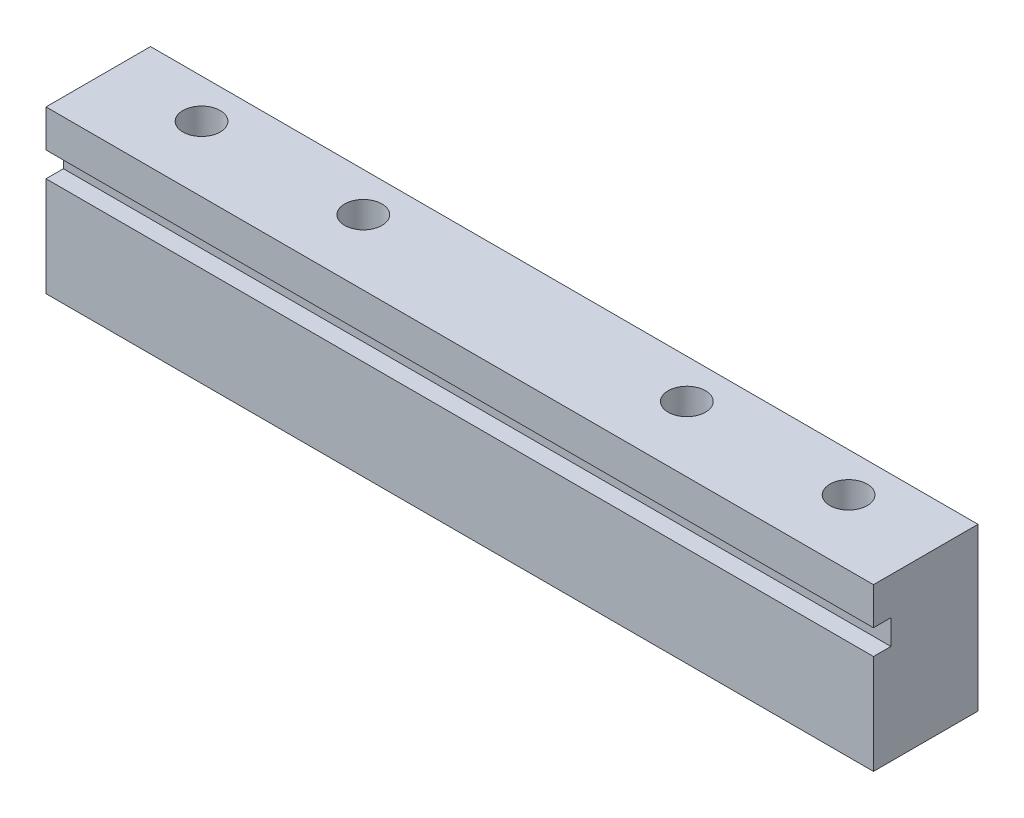
from build123d import *

# Parameters (mm, degrees)
SKETCH_1_W          = 66.5
SKETCH_1_H          = 8.4
EXTRUDE_1_DEPTH     = 13
SKETCH_2_W          = 1.4
SKETCH_2_H          = 2
CUT_EXTRUDE_1_DEPTH = 104
SKETCH_4_R          = 1.5
CUT_EXTRUDE_3_DEPTH = 36.947218251


with BuildPart() as part:
    # 草图1 → 凸台-拉伸1 (new body)
    with BuildSketch(Plane(origin=(0, 0, 0), x_dir=(1, 0, 0), z_dir=(0, 1, 0))):
        Rectangle(SKETCH_1_W, SKETCH_1_H)
    extrude(amount=EXTRUDE_1_DEPTH)

    # 草图2 → 切除-拉伸1 (cut)
    with BuildSketch(Plane(origin=(33.25, 0, 0), x_dir=(0, 0, -1), z_dir=(1, 0, 0))):
        with Locations((-3.5, 9)):
            Rectangle(SKETCH_2_W, SKETCH_2_H)
    extrude(amount=-CUT_EXTRUDE_1_DEPTH, mode=Mode.SUBTRACT)

    # 草图4 → 切除-拉伸3 (cut, through all)
    with BuildSketch(Plane.XZ):
        with Locations(Location((-26, -1.05, 0), (0, 0, 270))):
            Circle(SKETCH_4_R)
        with Locations(Location((-13, -1.05, 0), (0, 0, 270))):
            Circle(SKETCH_4_R)
        with Locations(Location((26, -1.05, 0), (0, 0, 270))):
            Circle(SKETCH_4_R)
        with Locations(Location((13, -1.05, 0), (0, 0, 270))):
            Circle(SKETCH_4_R)
    extrude(amount=-CUT_EXTRUDE_3_DEPTH, mode=Mode.SUBTRACT)


solid = part.part
